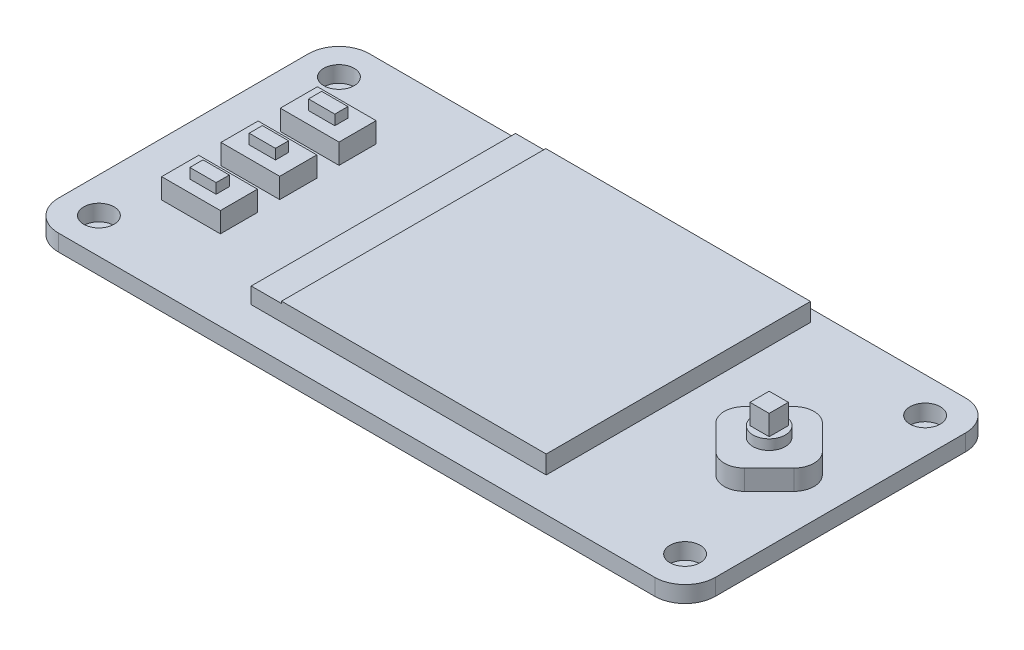
from build123d import *

# Parameters (mm, degrees)
EXTRUDE_1_DEPTH     = 1.63
SKETCH_2_R          = 1.5
CUT_EXTRUDE_1_DEPTH = 1.6
SKETCH_3_W          = 29.19
SKETCH_3_H          = 26.15
EXTRUDE_2_DEPTH     = 1.8
EXTRUDE_3_DEPTH     = 2
SKETCH_6_W          = 3
SKETCH_6_H          = 26.15
CUT_EXTRUDE_2_DEPTH = 0.2
SKETCH_4_W          = 5.81
SKETCH_4_H          = 3.67
EXTRUDE_4_DEPTH     = 2
SKETCH_7_W          = 2.6
SKETCH_7_H          = 1.3
EXTRUDE_5_DEPTH     = 1
SKETCH_8_W          = 51
SKETCH_8_H          = 5
EXTRUDE_6_DEPTH     = 3.68
SKETCH_9_W          = 1.9
SKETCH_9_H          = 1.9
EXTRUDE_7_DEPTH     = 3
SKETCH_10_R         = 1.6
EXTRUDE_8_DEPTH     = 1


with BuildPart() as part:
    # 草图1 → 凸台-拉伸1 (new body)
    with BuildSketch(Plane(origin=(0, 0, 0), x_dir=(1, 0, 0), z_dir=(0, 1, 0))):
        with BuildLine():
            Line((-29.5, 15.375), (29.5, 15.375))
            ThreePointArc((29.5, 15.375), (31.621320344, 14.496320344), (32.5, 12.375))
            Line((32.5, 12.375), (32.5, -12.375))
            ThreePointArc((32.5, -12.375), (31.621320344, -14.496320344), (29.5, -15.375))
            Line((29.5, -15.375), (-29.5, -15.375))
            ThreePointArc((-29.5, -15.375), (-31.621320344, -14.496320344), (-32.5, -12.375))
            Line((-32.5, -12.375), (-32.5, 12.375))
            ThreePointArc((-32.5, 12.375), (-31.621320344, 14.496320344), (-29.5, 15.375))
        make_face()
    extrude(amount=EXTRUDE_1_DEPTH)

    # 草图2 → 切除-拉伸1 (cut)
    with BuildSketch(Plane(origin=(0, 1.63, 0), x_dir=(1, 0, 0), z_dir=(0, 1, 0))):
        with Locations(Location((-29, 11.875, 0), (0, 0, 270))):
            Circle(SKETCH_2_R)
        with Locations(Location((-29, -11.875, 0), (0, 0, 270))):
            Circle(SKETCH_2_R)
        with Locations(Location((29, -11.875, 0), (0, 0, 270))):
            Circle(SKETCH_2_R)
        with Locations(Location((29, 11.875, 0), (0, 0, 270))):
            Circle(SKETCH_2_R)
    extrude(amount=-CUT_EXTRUDE_1_DEPTH, mode=Mode.SUBTRACT)

    # 草图3 → 凸台-拉伸2 (add)
    with BuildSketch(Plane(origin=(0, 1.63, 0), x_dir=(1, 0, 0), z_dir=(0, 1, 0))):
        with Locations((0.765, 1.1)):
            Rectangle(SKETCH_3_W, SKETCH_3_H)
    extrude(amount=EXTRUDE_2_DEPTH)

    # 草图5 → 凸台-拉伸3 (add)
    with BuildSketch(Plane(origin=(0, 1.63, 0), x_dir=(1, 0, 0), z_dir=(0, 1, 0))):
        with BuildLine():
            Line((26.574695167, 4.138250353), (29.014213562, 1.698731957))
            ThreePointArc((29.014213562, 1.698731957), (29.6, 0.284518395), (29.014213562, -1.129695167))
            Line((29.014213562, -1.129695167), (26.574695167, -3.569213562))
            ThreePointArc((26.574695167, -3.569213562), (25.160481605, -4.155), (23.746268043, -3.569213562))
            Line((23.746268043, -3.569213562), (21.306749647, -1.129695167))
            ThreePointArc((21.306749647, -1.129695167), (20.72096321, 0.284518395), (21.306749647, 1.698731957))
            Line((21.306749647, 1.698731957), (23.746268043, 4.138250353))
            ThreePointArc((23.746268043, 4.138250353), (25.160481605, 4.72403679), (26.574695167, 4.138250353))
        make_face()
    extrude(amount=EXTRUDE_3_DEPTH)

    # 草图6 → 切除-拉伸2 (cut)
    with BuildSketch(Plane(origin=(0, 3.43, 0), x_dir=(1, 0, 0), z_dir=(0, 1, 0))):
        with Locations((-12.33, 1.1)):
            Rectangle(SKETCH_6_W, SKETCH_6_H)
    extrude(amount=-CUT_EXTRUDE_2_DEPTH, mode=Mode.SUBTRACT)

    # 草图4 → 凸台-拉伸4 (add)
    with BuildSketch(Plane(origin=(0, 1.63, 0), x_dir=(1, 0, 0), z_dir=(0, 1, 0))):
        with Locations((-24.325, 6.14)):
            Rectangle(SKETCH_4_W, SKETCH_4_H)
        with Locations((-24.325, 0.27)):
            Rectangle(SKETCH_4_W, SKETCH_4_H)
        with Locations((-24.325, -5.6)):
            Rectangle(SKETCH_4_W, SKETCH_4_H)
    extrude(amount=EXTRUDE_4_DEPTH)

    # 草图7 → 凸台-拉伸5 (add)
    with BuildSketch(Plane(origin=(0, 3.63, 0), x_dir=(1, 0, 0), z_dir=(0, 1, 0))):
        with Locations((-24.325, 6.14)):
            Rectangle(SKETCH_7_W, SKETCH_7_H)
        with Locations((-24.325, 0.27)):
            Rectangle(SKETCH_7_W, SKETCH_7_H)
        with Locations((-24.325, -5.6)):
            Rectangle(SKETCH_7_W, SKETCH_7_H)
    extrude(amount=EXTRUDE_5_DEPTH)

    # 草图8 → 凸台-拉伸6 (add)
    with BuildSketch(Plane.XZ):
        with Locations((-0.2, -11.235)):
            Rectangle(SKETCH_8_W, SKETCH_8_H)
    extrude(amount=EXTRUDE_6_DEPTH)

    # 草图9 → 凸台-拉伸7 (add)
    with BuildSketch(Plane(origin=(0, 3.63, 0), x_dir=(1, 0, 0), z_dir=(0, 1, 0))):
        with Locations((25.160481605, 0.284518395)):
            Rectangle(SKETCH_9_W, SKETCH_9_H)
    extrude(amount=EXTRUDE_7_DEPTH)

    # 草图10 → 凸台-拉伸8 (add)
    with BuildSketch(Plane(origin=(0, 3.63, 0), x_dir=(1, 0, 0), z_dir=(0, 1, 0))):
        with Locations(Location((25.160481605, 0.284518395, 0), (0, 0, 90))):
            Circle(SKETCH_10_R)
    extrude(amount=EXTRUDE_8_DEPTH)


solid = part.part
